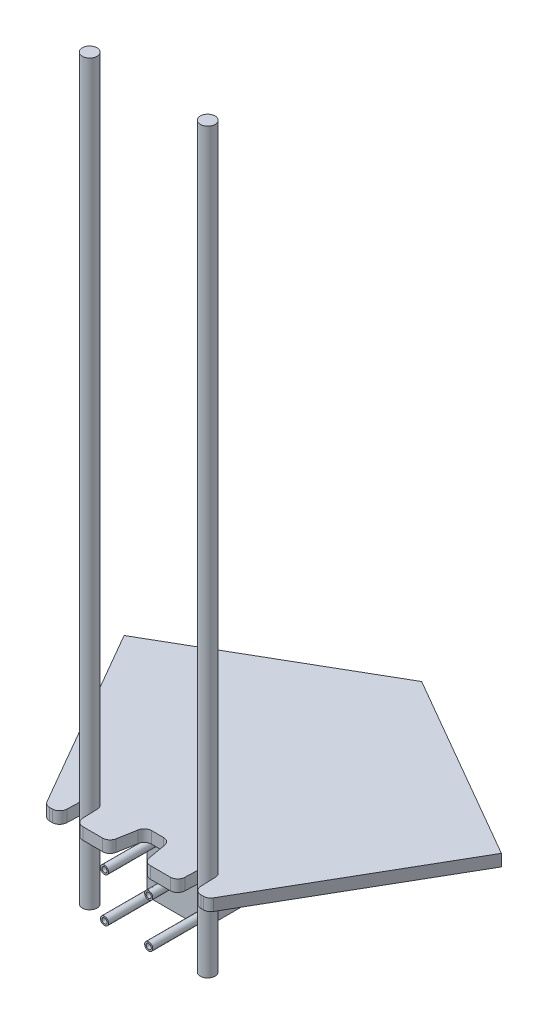
from build123d import *

# Parameters (mm, degrees)
BOSS_EXTRUDE1_DEPTH        = 8
CUT_EXTRUDE1_DEPTH         = 8
CUT_EXTRUDE2_DEPTH         = 8
FILLET1_R                  = 5
BOSS_EXTRUDE2_DEPTH        = 450
BOSS_EXTRUDE2_DEPTH_BACK   = 50
SKETCH5_R                  = 5
BOSS_EXTRUDE2_2_DEPTH      = 450
BOSS_EXTRUDE2_2_DEPTH_BACK = 50
SKETCH7_R                  = 2.75
SKETCH7_R_2                = 1.75
BOSS_EXTRUDE3_DEPTH        = 35
BOSS_EXTRUDE3_2_DEPTH      = 35
BOSS_EXTRUDE3_3_DEPTH      = 35
BOSS_EXTRUDE3_4_DEPTH      = 35
SKETCH8_W                  = 42.3
SKETCH8_H                  = 42.3
SKETCH8_R                  = 1.5
BOSS_EXTRUDE4_DEPTH        = 40
CHAMFER1_SIZE              = 4


with BuildPart() as part:
    # Sketch2 → Boss-Extrude1 (new body)
    with BuildSketch(Plane(origin=(0, 0, 0), x_dir=(1, 0, 0), z_dir=(0, 1, 0))):
        Polygon((-55, -200), (55, -200), (127.852540378, -73.815698604), (0, 0), (-127.852540378, -73.815698604), align=None)
    extrude(amount=BOSS_EXTRUDE1_DEPTH)

    # Sketch4 → Cut-Extrude1 (cut)
    with BuildSketch(Plane(origin=(0, 8, 0), x_dir=(1, 0, 0), z_dir=(0, 1, 0))):
        with BuildLine():
            Line((44.996954135, -184.825502516), (45.526859264, -200))
            Line((45.526859264, -200), (34.473140736, -200))
            Line((34.473140736, -200), (35.003045865, -184.825502516))
            ThreePointArc((35.003045865, -184.825502516), (40, -180), (44.996954135, -184.825502516))
        make_face()
        with BuildLine():
            Line((-34.473140736, -200), (-45.526859264, -200))
            Line((-45.526859264, -200), (-44.996954135, -184.825502516))
            ThreePointArc((-44.996954135, -184.825502516), (-40, -180), (-35.003045865, -184.825502516))
            Line((-35.003045865, -184.825502516), (-34.473140736, -200))
        make_face()
    extrude(amount=-CUT_EXTRUDE1_DEPTH, mode=Mode.SUBTRACT)

    # Sketch6 → Cut-Extrude2 (cut)
    with BuildSketch(Plane(origin=(0, 8, 0), x_dir=(1, 0, 0), z_dir=(0, 1, 0))):
        Polygon((-8.25, -179), (-11.952866595, -200), (0, -200), (11.952866595, -200), (8.25, -179), align=None)
    extrude(amount=-CUT_EXTRUDE2_DEPTH, mode=Mode.SUBTRACT)

    # Fillet1
    fillet1_edges = [part.edges().sort_by_distance(p)[0] for p in [
        (45.526859264, 4, 200),
        (34.473140736, 4, 200),
        (-34.473140736, 4, 200),
        (-45.526859264, 4, 200),
        (-55, 4, 200),
        (55, 4, 200),
        (-11.952866595, 4, 200),
        (-8.25, 4, 179),
        (11.952866595, 4, 200),
        (8.25, 4, 179),
    ]]
    fillet(fillet1_edges, radius=FILLET1_R)


with BuildPart() as body_2:
    # Sketch5 → Boss-Extrude2 (new, two sides: drawn at the far end of the back side and taken through both)
    with BuildSketch(Plane(origin=(0, 0, 0), x_dir=(1, 0, 0), z_dir=(0, 1, 0)).offset(-BOSS_EXTRUDE2_DEPTH_BACK)):
        with Locations((40, -185)):
            Circle(SKETCH5_R)
    extrude(amount=BOSS_EXTRUDE2_DEPTH + BOSS_EXTRUDE2_DEPTH_BACK)


with BuildPart() as body_3:
    # Sketch5 → Boss-Extrude2 2 (new, two sides: drawn at the far end of the back side and taken through both)
    with BuildSketch(Plane(origin=(0, 0, 0), x_dir=(1, 0, 0), z_dir=(0, 1, 0)).offset(-BOSS_EXTRUDE2_2_DEPTH_BACK)):
        with Locations((-40, -185)):
            Circle(SKETCH5_R)
    extrude(amount=BOSS_EXTRUDE2_2_DEPTH + BOSS_EXTRUDE2_2_DEPTH_BACK)


with BuildPart() as body_4:
    # Sketch7 → Boss-Extrude3 (new body)
    with BuildSketch(Plane.XY.offset(200)):
        with Locations((-15, -10)):
            Circle(SKETCH7_R)
        with Locations((-15, -10)):
            Circle(SKETCH7_R_2, mode=Mode.SUBTRACT)
    extrude(amount=-BOSS_EXTRUDE3_DEPTH)


with BuildPart() as body_5:
    # Sketch7 → Boss-Extrude3 2 (new body)
    with BuildSketch(Plane.XY.offset(200)):
        with Locations((-15, -40)):
            Circle(SKETCH7_R)
        with Locations((-15, -40)):
            Circle(SKETCH7_R_2, mode=Mode.SUBTRACT)
    extrude(amount=-BOSS_EXTRUDE3_2_DEPTH)


with BuildPart() as body_6:
    # Sketch7 → Boss-Extrude3 3 (new body)
    with BuildSketch(Plane.XY.offset(200)):
        with Locations((15, -40)):
            Circle(SKETCH7_R)
        with Locations((15, -40)):
            Circle(SKETCH7_R_2, mode=Mode.SUBTRACT)
    extrude(amount=-BOSS_EXTRUDE3_3_DEPTH)


with BuildPart() as body_7:
    # Sketch7 → Boss-Extrude3 4 (new body)
    with BuildSketch(Plane.XY.offset(200)):
        with Locations((15, -10)):
            Circle(SKETCH7_R)
        with Locations((15, -10)):
            Circle(SKETCH7_R_2, mode=Mode.SUBTRACT)
    extrude(amount=-BOSS_EXTRUDE3_4_DEPTH)


with BuildPart() as body_8:
    # Sketch8 → Boss-Extrude4 (new body)
    with BuildSketch(Plane(origin=(0, 0, 165), x_dir=(-1, 0, 0), z_dir=(0, 0, -1))):
        with Locations((0, -25)):
            Rectangle(SKETCH8_W, SKETCH8_H)
        with Locations((-15, -10)):
            Circle(SKETCH8_R, mode=Mode.SUBTRACT)
        with Locations((-15, -40)):
            Circle(SKETCH8_R, mode=Mode.SUBTRACT)
        with Locations((15, -40)):
            Circle(SKETCH8_R, mode=Mode.SUBTRACT)
        with Locations((15, -10)):
            Circle(SKETCH8_R, mode=Mode.SUBTRACT)
    extrude(amount=BOSS_EXTRUDE4_DEPTH)

    # Chamfer1
    chamfer1_edges = [body_8.edges().sort_by_distance(p)[0] for p in [
        (-21.15, -3.85, 145),
        (-21.15, -46.15, 145),
        (21.15, -3.85, 145),
        (21.15, -46.15, 145),
    ]]
    chamfer(chamfer1_edges, length=CHAMFER1_SIZE)


solid = Compound([part.part, body_2.part, body_3.part, body_4.part, body_5.part, body_6.part, body_7.part, body_8.part])
